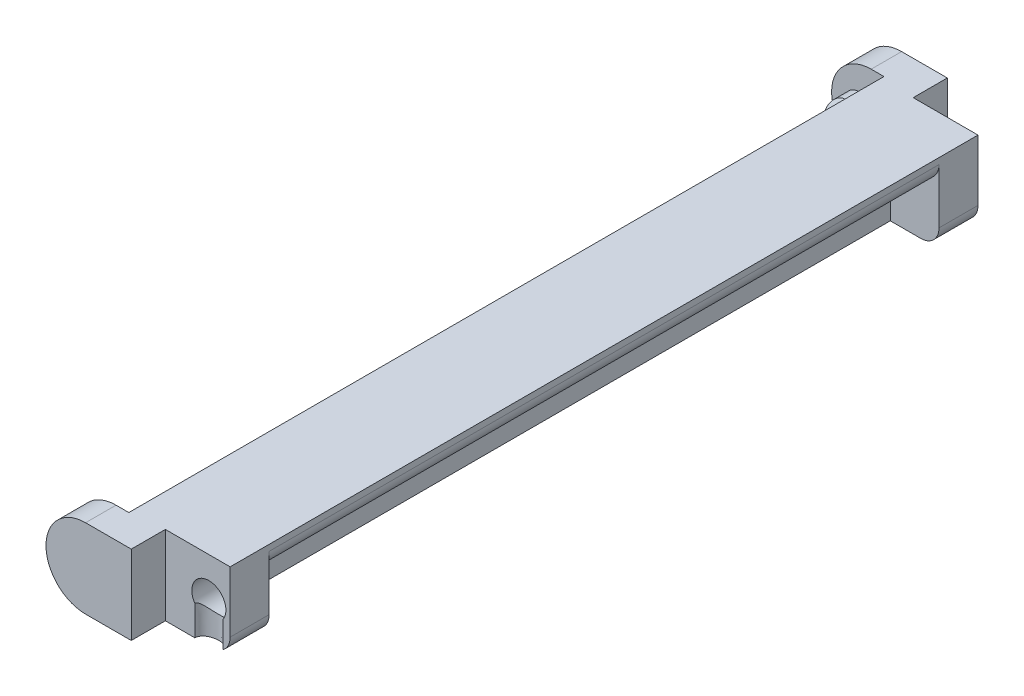
from build123d import *

# Parameters (mm, degrees)
BOSS_EXTRUDE1_DEPTH = 6.5
CUT_EXTRUDE3_DEPTH  = 68.659163459
SKETCH4_W           = 4
SKETCH4_H           = 55
SKETCH4_W_2         = 1.7
SKETCH4_H_2         = 62
CUT_EXTRUDE4_DEPTH  = 4.5
SKETCH5_R           = 1.15
BOSS_EXTRUDE2_DEPTH = 2
FILLET1_R           = 1.5
CUT_EXTRUDE5_REACH  = 36.8
SKETCH7_W           = 5.32
SKETCH7_H           = 0.3
SKETCH6_R           = 1.4
CUT_EXTRUDE6_DEPTH  = 2.8
FILLET2_R           = 1.5
FILLET3_R           = 1.5
CUT_EXTRUDE7_REACH  = 37.922
CUT_EXTRUDE8_START  = -2.451564
SKETCH10_RX         = 1.15
SKETCH10_RY         = 0.8
CUT_EXTRUDE8_DEPTH  = 2.451564


with BuildPart() as part:
    # Sketch1 → Boss-Extrude1 (new body)
    with BuildSketch(Plane(origin=(0, 0, 0), x_dir=(1, 0, 0), z_dir=(0, 1, 0))):
        Polygon((1.5, -31), (6.82, -31), (6.82, 31), (1.5, 31), (1.5, 33.5), (-5.5, 33.5), (-5.5, 31), (-1.2, 31), (-1.2, -31), (-5.5, -31), (-5.5, -33.5), (1.5, -33.5), align=None)
    extrude(amount=-BOSS_EXTRUDE1_DEPTH)

    # Sketch3 → Cut-Extrude3 (cut, through all)
    with BuildSketch(Plane.XY.offset(33.5)):
        with BuildLine():
            Line((-5.5, 0), (-5.5, -3.25))
            ThreePointArc((-5.5, -3.25), (-4.548097039, -0.951902961), (-2.25, 0))
            Line((-2.25, 0), (-5.5, 0))
        make_face()
        with BuildLine():
            Line((-5.5, -6.5), (-2.25, -6.5))
            ThreePointArc((-2.25, -6.5), (-4.548097039, -5.548097039), (-5.5, -3.25))
            Line((-5.5, -3.25), (-5.5, -6.5))
        make_face()
    extrude(amount=-CUT_EXTRUDE3_DEPTH, mode=Mode.SUBTRACT)

    # Sketch4 → Cut-Extrude4 (cut)
    with BuildSketch(Plane.XZ.offset(6.5)):
        with Locations((4.82, 0)):
            Rectangle(SKETCH4_W, SKETCH4_H)
        with Locations((-0.35, 0)):
            Rectangle(SKETCH4_W_2, SKETCH4_H_2)
    extrude(amount=-CUT_EXTRUDE4_DEPTH, mode=Mode.SUBTRACT)

    # Sketch5 → Boss-Extrude2 (add)
    with BuildSketch(Plane.XY.offset(-31)):
        with Locations((-3.25, -3.25)):
            Circle(SKETCH5_R)
    boss_extrude2 = extrude(amount=BOSS_EXTRUDE2_DEPTH)

    # Fillet1
    fillet1_edges = [part.edges().sort_by_distance(p)[0] for p in [
        (-1.2, -2, 0),
    ]]
    fillet(fillet1_edges, radius=FILLET1_R)

    # Sketch7 → Cut-Extrude5 (cut, up to next)
    with BuildSketch(Plane(origin=(0, 0, 0), x_dir=(1, 0, 0), z_dir=(0, 1, 0)), mode=Mode.PRIVATE) as cut_extrude5_sk1:
        with Locations((4.16, 30.85)):
            Rectangle(SKETCH7_W, SKETCH7_H)
    cut_extrude5_tool1 = extrude(cut_extrude5_sk1.sketch, amount=-CUT_EXTRUDE5_REACH, mode=Mode.PRIVATE) & part.part
    cut_extrude5 = cut_extrude5_tool1.solids().sort_by_distance((4.16, 0, -30.85))[0]
    add(cut_extrude5, mode=Mode.SUBTRACT)

    # Sketch6 → Cut-Extrude6 (cut)
    with BuildSketch(Plane(origin=(0, 0, -31), x_dir=(-1, 0, 0), z_dir=(0, 0, -1))):
        with Locations((-5.07, -3.25)):
            Circle(SKETCH6_R)
    cut_extrude6 = extrude(amount=-CUT_EXTRUDE6_DEPTH, mode=Mode.SUBTRACT)

    # Mirror2: Boss-Extrude2, Cut-Extrude5, Cut-Extrude6 across plane
    add(boss_extrude2.mirror(Plane.XY))
    add(cut_extrude5.mirror(Plane.XY), mode=Mode.SUBTRACT)
    add(cut_extrude6.mirror(Plane.XY), mode=Mode.SUBTRACT)

    # Fillet2
    fillet2_edges = [part.edges().sort_by_distance(p)[0] for p in [
        (6.82, -2, 0),
    ]]
    fillet(fillet2_edges, radius=FILLET2_R)

    # Fillet3
    fillet3_edges = [part.edges().sort_by_distance(p)[0] for p in [
        (6.82, -6.5, 29.1),
        (6.82, -6.5, -29.1),
    ]]
    fillet(fillet3_edges, radius=FILLET3_R)

    # Sketch9 → Cut-Extrude7 (cut, up to next)
    with BuildSketch(Plane.ZY.offset(4.4), mode=Mode.PRIVATE) as cut_extrude7_sk1:
        Polygon((-29, -3.95), (-29.9, -2.1), (-29, -2.1), align=None)
    cut_extrude7_tool1 = extrude(cut_extrude7_sk1.sketch, amount=-CUT_EXTRUDE7_REACH, mode=Mode.PRIVATE) & part.part
    cut_extrude7 = cut_extrude7_tool1.solids().sort_by_distance((-4.4, -2.716667, -29.3))[0]
    add(cut_extrude7, mode=Mode.SUBTRACT)

    # Sketch10 → Cut-Extrude8 (cut)
    with BuildSketch(Plane.XZ.offset(6.5).offset(CUT_EXTRUDE8_START)):
        with Locations(Location((5.07, -30.7), (0, 0, 180))):
            Ellipse(SKETCH10_RX, SKETCH10_RY)
    cut_extrude8 = extrude(amount=CUT_EXTRUDE8_DEPTH, mode=Mode.SUBTRACT)

    # Mirror3: Cut-Extrude7, Cut-Extrude8 across plane
    add(cut_extrude7.mirror(Plane.XY), mode=Mode.SUBTRACT)
    add(cut_extrude8.mirror(Plane.XY), mode=Mode.SUBTRACT)


solid = part.part
